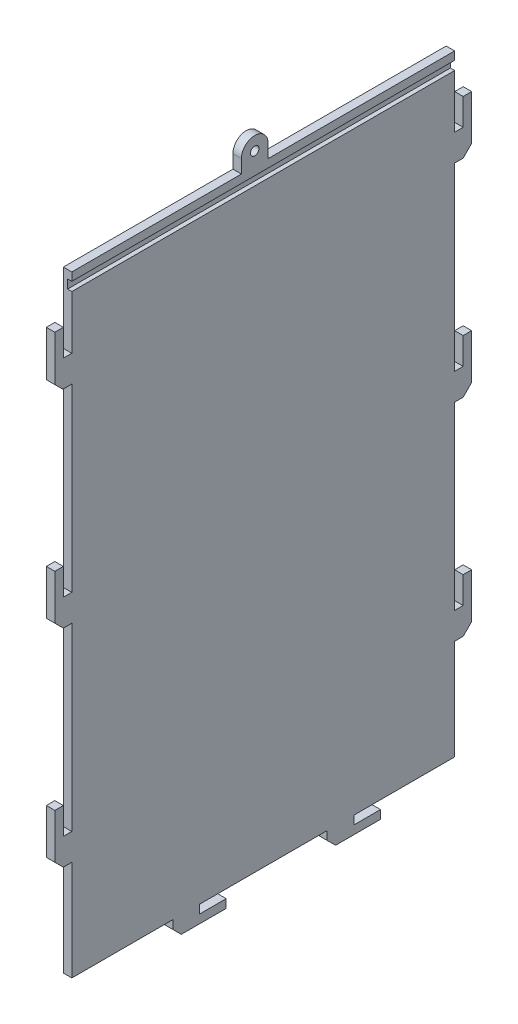
from build123d import *

# Parameters (mm, degrees)
SKETCH2_R           = 3.175
BOSS_EXTRUDE1_DEPTH = 6.35
SKETCH3_W           = 3.175
SKETCH3_H           = 6.604
CUT_EXTRUDE1_DEPTH  = 551.59524986


with BuildPart() as part:
    # Sketch2 → Boss-Extrude1 (new body)
    with BuildSketch(Plane(origin=(0, 0, 0), x_dir=(0, 0, -1), z_dir=(1, 0, 0))):
        with BuildLine():
            Line((12.003150763, 442.097734975), (138.953150763, 442.097734975))
            Line((138.953150763, 442.097734975), (138.953150763, 452.097734975))
            ThreePointArc((138.953150763, 452.097734975), (148.953150763, 462.097734975), (158.953150763, 452.097734975))
            Line((158.953150763, 452.097734975), (158.953150763, 442.097734975))
            Line((158.953150763, 442.097734975), (298.603150763, 442.097734975))
            Line((298.603150763, 442.097734975), (298.603150763, 389.397734975))
            Line((298.603150763, 389.397734975), (304.953150763, 389.397734975))
            Line((304.953150763, 389.397734975), (304.953150763, 409.397734975))
            Line((304.953150763, 409.397734975), (311.303150763, 409.397734975))
            Line((311.303150763, 409.397734975), (311.303150763, 375.747734975))
            Line((311.303150763, 375.747734975), (304.953150763, 369.397734975))
            Line((304.953150763, 369.397734975), (298.603150763, 369.397734975))
            Line((298.603150763, 369.397734975), (298.603150763, 234.397734975))
            Line((298.603150763, 234.397734975), (304.953150763, 234.397734975))
            Line((304.953150763, 234.397734975), (304.953150763, 254.397734975))
            Line((304.953150763, 254.397734975), (311.303150763, 254.397734975))
            Line((311.303150763, 254.397734975), (311.303150763, 220.747734975))
            Line((311.303150763, 220.747734975), (304.953150763, 214.397734975))
            Line((304.953150763, 214.397734975), (298.603150763, 214.397734975))
            Line((298.603150763, 214.397734975), (298.603150763, 79.397734975))
            Line((298.603150763, 79.397734975), (304.953150763, 79.397734975))
            Line((304.953150763, 79.397734975), (304.953150763, 99.397734975))
            Line((304.953150763, 99.397734975), (311.303150763, 99.397734975))
            Line((311.303150763, 99.397734975), (311.303150763, 65.747734975))
            Line((311.303150763, 65.747734975), (304.953150763, 59.397734975))
            Line((304.953150763, 59.397734975), (298.603150763, 59.397734975))
            Line((298.603150763, 59.397734975), (298.603150763, -15.602265025))
            Line((298.603150763, -15.602265025), (223.103150763, -15.602265025))
            Line((223.103150763, -15.602265025), (223.103150763, -21.952265025))
            Line((223.103150763, -21.952265025), (243.103150763, -21.952265025))
            Line((243.103150763, -21.952265025), (243.103150763, -28.302265025))
            Line((243.103150763, -28.302265025), (209.453150763, -28.302265025))
            Line((209.453150763, -28.302265025), (203.103150763, -21.952265025))
            Line((203.103150763, -21.952265025), (203.103150763, -15.602265025))
            Line((203.103150763, -15.602265025), (107.603150763, -15.602265025))
            Line((107.603150763, -15.602265025), (107.603150763, -21.952265025))
            Line((107.603150763, -21.952265025), (127.603150763, -21.952265025))
            Line((127.603150763, -21.952265025), (127.603150763, -28.302265025))
            Line((127.603150763, -28.302265025), (93.953150763, -28.302265025))
            Line((93.953150763, -28.302265025), (87.603150763, -21.952265025))
            Line((87.603150763, -21.952265025), (87.603150763, -15.602265025))
            Line((87.603150763, -15.602265025), (12.003150763, -15.602265025))
            Line((12.003150763, -15.602265025), (12.003150763, 59.397734975))
            Line((12.003150763, 59.397734975), (5.653150763, 59.397734975))
            Line((5.653150763, 59.397734975), (-0.696849237, 65.747734975))
            Line((-0.696849237, 65.747734975), (-0.696849237, 99.397734975))
            Line((-0.696849237, 99.397734975), (5.653150763, 99.397734975))
            Line((5.653150763, 99.397734975), (5.653150763, 79.397734975))
            Line((5.653150763, 79.397734975), (12.003150763, 79.397734975))
            Line((12.003150763, 79.397734975), (12.003150763, 214.366115656))
            Line((12.003150763, 214.366115656), (12.003150763, 214.397734975))
            Line((12.003150763, 214.397734975), (5.653150763, 214.397734975))
            Line((5.653150763, 214.397734975), (-0.696849237, 220.747734975))
            Line((-0.696849237, 220.747734975), (-0.696849237, 254.397734975))
            Line((-0.696849237, 254.397734975), (5.653150763, 254.397734975))
            Line((5.653150763, 254.397734975), (5.653150763, 234.397734975))
            Line((5.653150763, 234.397734975), (12.003150763, 234.397734975))
            Line((12.003150763, 234.397734975), (12.003150763, 369.397734975))
            Line((12.003150763, 369.397734975), (5.313181696, 369.397734975))
            Line((5.313181696, 369.397734975), (-0.696849237, 375.407765908))
            Line((-0.696849237, 375.407765908), (-0.696849237, 409.397734975))
            Line((-0.696849237, 409.397734975), (5.653150763, 409.397734975))
            Line((5.653150763, 409.397734975), (5.653150763, 389.397734975))
            Line((5.653150763, 389.397734975), (12.003150763, 389.397734975))
            Line((12.003150763, 389.397734975), (12.003150763, 442.097734975))
        make_face()
        with Locations((148.953150763, 452.097734975)):
            Circle(SKETCH2_R, mode=Mode.SUBTRACT)
    extrude(amount=BOSS_EXTRUDE1_DEPTH)

    # Sketch3 → Cut-Extrude1 (cut, through all)
    with BuildSketch(Plane.XY.offset(-12.003150763)):
        with Locations((4.7625, 432.699734975)):
            Rectangle(SKETCH3_W, SKETCH3_H)
    extrude(amount=-CUT_EXTRUDE1_DEPTH, mode=Mode.SUBTRACT)


solid = part.part
